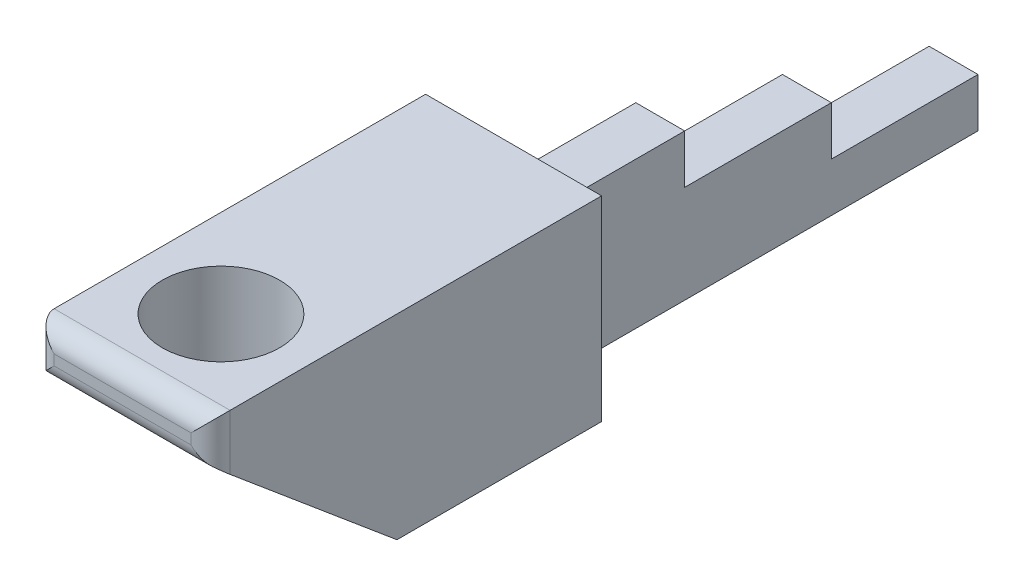
from build123d import *

# Parameters (mm, degrees)
EXTRUDE_1_DEPTH     = 9
EXTRUDE_2_DEPTH     = 2.5
SKETCH_2_R          = 6
CUT_EXTRUDE_1_DEPTH = 35
FILLET_2_R          = 2


with BuildPart() as part:
    # Эскиз1 → Бобышка-Вытянуть1 (new, symmetric)
    with BuildSketch(Plane(origin=(0, 0, 0), x_dir=(0, 0, -1), z_dir=(1, 0, 0))):
        Polygon((-19.068057482, 16), (0, 0), (20.931942518, 0), (20.931942518, 15), (20.931942518, 20), (-19.068057482, 20), align=None)
    extrude(amount=EXTRUDE_1_DEPTH, both=True)

    # Эскиз1<3> → Бобышка-Вытянуть2 (add, symmetric)
    with BuildSketch(Plane(origin=(0, 0, 0), x_dir=(0, 0, -1), z_dir=(1, 0, 0))):
        Polygon((20.931942518, 15), (20.931942518, 0), (65.931942518, 0), (65.931942518, 5), (50.931942518, 5), (50.931942518, 10), (35.931942518, 10), (35.931942518, 15), align=None)
    extrude(amount=EXTRUDE_2_DEPTH, both=True)

    # Эскиз2 → Вырез-Вытянуть1 (cut)
    with BuildSketch(Plane(origin=(0, 20, 0), x_dir=(1, 0, 0), z_dir=(0, 1, 0))):
        with Locations((0, -9)):
            Circle(SKETCH_2_R)
    extrude(amount=-CUT_EXTRUDE_1_DEPTH, mode=Mode.SUBTRACT)

    # Скругление2
    fillet_2_edges = [part.edges().sort_by_distance(p)[0] for p in [
        (0, 20, 19.068057482),
        (9, 18, 19.068057482),
        (0, 16, 19.068057482),
        (-9, 18, 19.068057482),
    ]]
    fillet(fillet_2_edges, radius=FILLET_2_R)


solid = part.part
